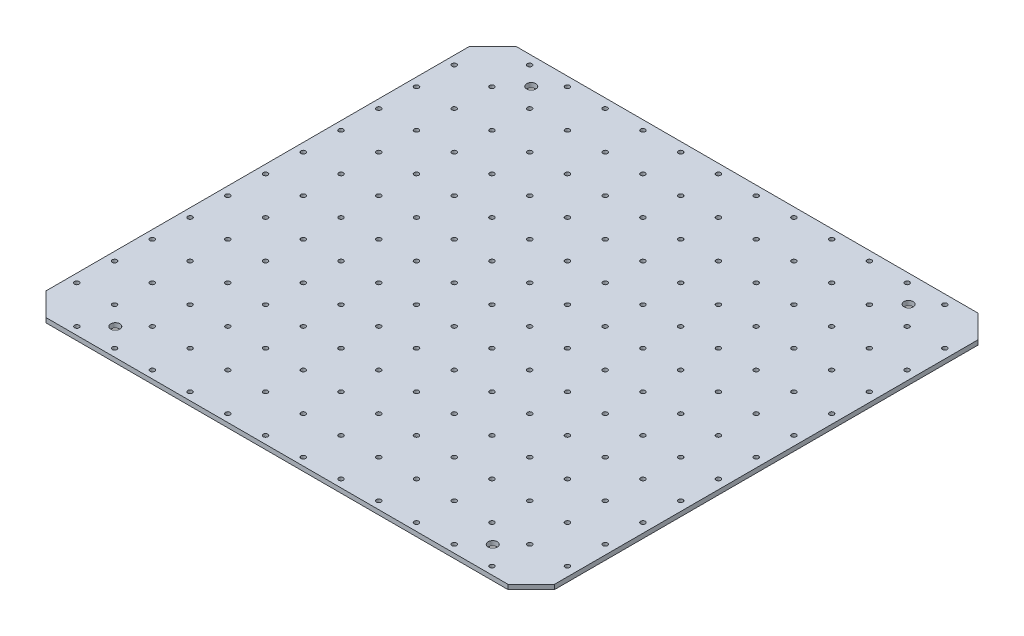
from build123d import *

# Parameters (mm, degrees)
BOSS_EXTRUDE1_DEPTH       = 3
F_3_0MM_DOWEL_SLOT3_D     = 3
F_3_0MM_DOWEL_SLOT3_DEPTH = 5.2
F_3_0MM_DOWEL_SLOT3_TIP   = 0.901290929
F_6_0MM_DOWEL_SLOT1_D     = 6


with BuildPart() as part:
    # Sketch3 → Boss-Extrude1 (new body)
    with BuildSketch(Plane(origin=(0, 0, 0), x_dir=(1, 0, 0), z_dir=(0, 1, 0))):
        Polygon((-289.107709539, -12.001540078), (-289.107709539, 262.998459922), (-274.107709539, 277.998459922), (25.892290461, 277.998459922), (40.892290461, 262.998459922), (40.892290461, -12.001540078), (25.892290461, -27.001540078), (-274.107709539, -27.001540078), align=None)
    extrude(amount=BOSS_EXTRUDE1_DEPTH)

    # Ø3.0mm Dowel Slot3
    with Locations(Plane(origin=(0, 3, 0), x_dir=(1, 0, 0), z_dir=(0, 1, 0))):
        with Locations((-259.107709539, -22.001540078), (-234.607709539, -22.001540078), (-210.107709539, -22.001540078), (-185.607709539, -22.001540078), (-161.107709539, -22.001540078), (-136.607709539, -22.001540078), (-112.107709539, -22.001540078), (-87.607709539, -22.001540078), (-63.107709539, -22.001540078), (-38.607709539, -22.001540078), (-14.107709539, -22.001540078), (10.392290461, -22.001540078), (-259.107709539, 2.498459922), (-259.107709539, 26.998459922), (-259.107709539, 51.498459922), (-259.107709539, 75.998459922), (-259.107709539, 100.498459922), (-259.107709539, 124.998459922), (-259.107709539, 149.498459922), (-259.107709539, 173.998459922), (-259.107709539, 198.498459922), (-259.107709539, 222.998459922), (-259.107709539, 247.498459922), (-259.107709539, 271.998459922), (-234.607709539, 2.498459922), (-210.107709539, 2.498459922), (-185.607709539, 2.498459922), (-161.107709539, 2.498459922), (-136.607709539, 2.498459922), (-112.107709539, 2.498459922), (-87.607709539, 2.498459922), (-63.107709539, 2.498459922), (-38.607709539, 2.498459922), (-14.107709539, 2.498459922), (10.392290461, 2.498459922), (-234.607709539, 26.998459922), (-210.107709539, 26.998459922), (-185.607709539, 26.998459922), (-161.107709539, 26.998459922), (-136.607709539, 26.998459922), (-112.107709539, 26.998459922), (-87.607709539, 26.998459922), (-63.107709539, 26.998459922), (-38.607709539, 26.998459922), (-14.107709539, 26.998459922), (10.392290461, 26.998459922), (-234.607709539, 51.498459922), (-210.107709539, 51.498459922), (-185.607709539, 51.498459922), (-161.107709539, 51.498459922), (-136.607709539, 51.498459922), (-112.107709539, 51.498459922), (-87.607709539, 51.498459922), (-63.107709539, 51.498459922), (-38.607709539, 51.498459922), (-14.107709539, 51.498459922), (10.392290461, 51.498459922), (-234.607709539, 75.998459922), (-210.107709539, 75.998459922), (-185.607709539, 75.998459922), (-161.107709539, 75.998459922), (-136.607709539, 75.998459922), (-112.107709539, 75.998459922), (-87.607709539, 75.998459922), (-63.107709539, 75.998459922), (-38.607709539, 75.998459922), (-14.107709539, 75.998459922), (10.392290461, 75.998459922), (-234.607709539, 100.498459922), (-210.107709539, 100.498459922), (-185.607709539, 100.498459922), (-161.107709539, 100.498459922), (-136.607709539, 100.498459922), (-112.107709539, 100.498459922), (-87.607709539, 100.498459922), (-63.107709539, 100.498459922), (-38.607709539, 100.498459922), (-14.107709539, 100.498459922), (10.392290461, 100.498459922), (-234.607709539, 124.998459922), (-210.107709539, 124.998459922), (-185.607709539, 124.998459922), (-161.107709539, 124.998459922), (-136.607709539, 124.998459922), (-112.107709539, 124.998459922), (-87.607709539, 124.998459922), (-63.107709539, 124.998459922), (-38.607709539, 124.998459922), (-14.107709539, 124.998459922), (10.392290461, 124.998459922), (-234.607709539, 149.498459922), (-210.107709539, 149.498459922), (-185.607709539, 149.498459922), (-161.107709539, 149.498459922), (-136.607709539, 149.498459922), (-112.107709539, 149.498459922), (-87.607709539, 149.498459922), (-63.107709539, 149.498459922), (-38.607709539, 149.498459922), (-14.107709539, 149.498459922), (10.392290461, 149.498459922), (-234.607709539, 173.998459922), (-210.107709539, 173.998459922), (-185.607709539, 173.998459922), (-161.107709539, 173.998459922), (-136.607709539, 173.998459922), (-112.107709539, 173.998459922), (-87.607709539, 173.998459922), (-63.107709539, 173.998459922), (-38.607709539, 173.998459922), (-14.107709539, 173.998459922), (10.392290461, 173.998459922), (-234.607709539, 198.498459922), (-210.107709539, 198.498459922), (-185.607709539, 198.498459922), (-161.107709539, 198.498459922), (-136.607709539, 198.498459922), (-112.107709539, 198.498459922), (-87.607709539, 198.498459922), (-63.107709539, 198.498459922), (-38.607709539, 198.498459922), (-14.107709539, 198.498459922), (10.392290461, 198.498459922), (-234.607709539, 222.998459922), (-210.107709539, 222.998459922), (-185.607709539, 222.998459922), (-161.107709539, 222.998459922), (-136.607709539, 222.998459922), (-112.107709539, 222.998459922), (-87.607709539, 222.998459922), (-63.107709539, 222.998459922), (-38.607709539, 222.998459922), (-14.107709539, 222.998459922), (10.392290461, 222.998459922), (-234.607709539, 247.498459922), (-210.107709539, 247.498459922), (-185.607709539, 247.498459922), (-161.107709539, 247.498459922), (-136.607709539, 247.498459922), (-112.107709539, 247.498459922), (-87.607709539, 247.498459922), (-63.107709539, 247.498459922), (-38.607709539, 247.498459922), (-14.107709539, 247.498459922), (10.392290461, 247.498459922), (-234.607709539, 271.998459922), (-210.107709539, 271.998459922), (-185.607709539, 271.998459922), (-161.107709539, 271.998459922), (-136.607709539, 271.998459922), (-112.107709539, 271.998459922), (-87.607709539, 271.998459922), (-63.107709539, 271.998459922), (-38.607709539, 271.998459922), (-14.107709539, 271.998459922), (10.392290461, 271.998459922), (34.892290461, 2.498459922), (34.892290461, 26.998459922), (34.892290461, 51.498459922), (34.892290461, 75.998459922), (34.892290461, 100.498459922), (34.892290461, 124.998459922), (34.892290461, 149.498459922), (34.892290461, 173.998459922), (34.892290461, 198.498459922), (34.892290461, 222.998459922), (34.892290461, 247.498459922), (-283.607709539, 2.498459922), (-283.607709539, 26.998459922), (-283.607709539, 51.498459922), (-283.607709539, 75.998459922), (-283.607709539, 100.498459922), (-283.607709539, 124.998459922), (-283.607709539, 149.498459922), (-283.607709539, 173.998459922), (-283.607709539, 198.498459922), (-283.607709539, 222.998459922), (-283.607709539, 247.498459922)):
            Hole(F_3_0MM_DOWEL_SLOT3_D / 2, depth=F_3_0MM_DOWEL_SLOT3_DEPTH)
            with Locations((0, 0, -(F_3_0MM_DOWEL_SLOT3_DEPTH + F_3_0MM_DOWEL_SLOT3_TIP / 2))):  # 118° drill point
                Cone(0, F_3_0MM_DOWEL_SLOT3_D / 2, F_3_0MM_DOWEL_SLOT3_TIP, mode=Mode.SUBTRACT)

    # Ø6.0mm Dowel Slot1 (through all)
    with Locations(Plane(origin=(0, 3, 0), x_dir=(1, 0, 0), z_dir=(0, 1, 0))):
        with Locations((-1.607709539, -9.501540078), (-1.607709539, 260.498459922), (-246.607709539, 260.498459922), (-246.607709539, -9.501540078)):
            Hole(F_6_0MM_DOWEL_SLOT1_D / 2)


solid = part.part
